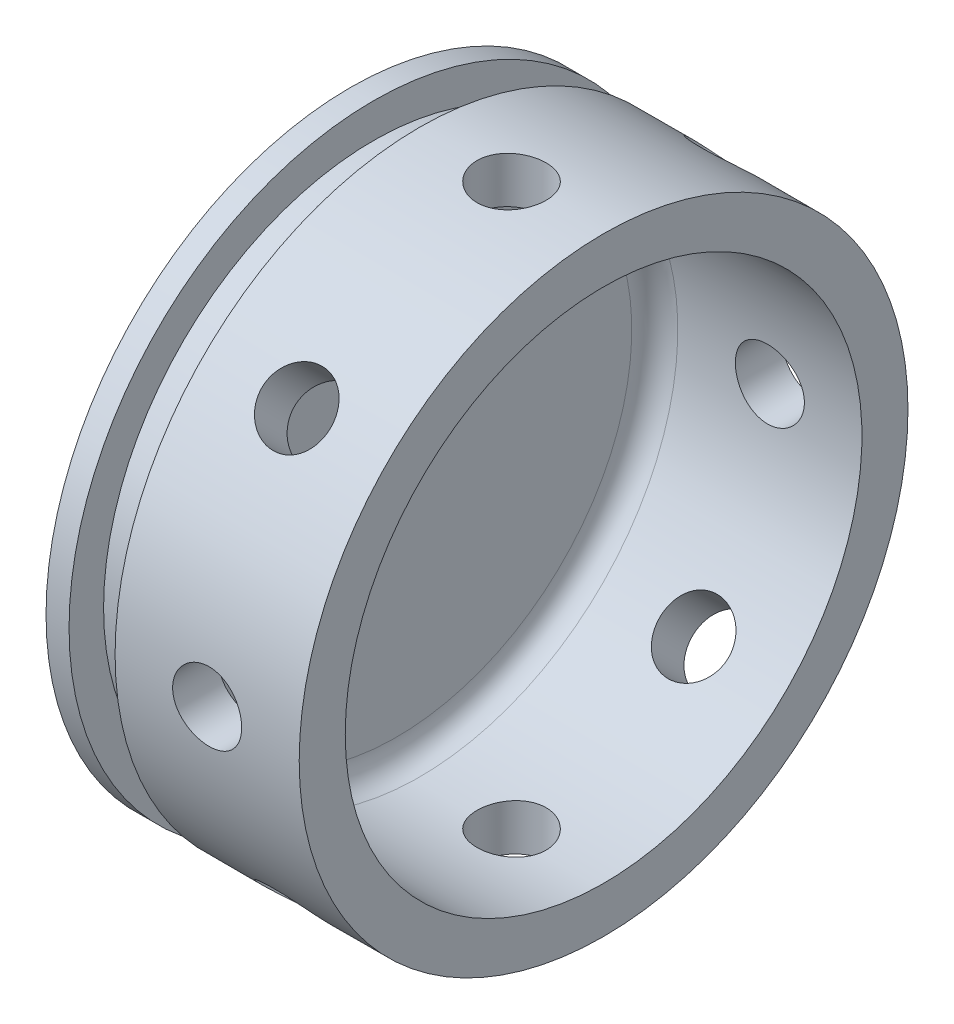
from build123d import *

# Parameters (mm, degrees)
SKETCH2_R          = 3
CUT_EXTRUDE1_DEPTH = 100
CIRPATTERN1_COUNT  = 8
FILLET1_R          = 2


with BuildPart() as part:
    # Sketch1 → Revolve1 (revolve)
    with BuildSketch(Plane(origin=(0, 0, 0), x_dir=(1, 0, 0), z_dir=(0, 1, 0)), mode=Mode.PRIVATE) as revolve1_sk:
        Polygon((0, 0), (0, 26.45), (2, 26.45), (2, 23.45), (6, 23.45), (6, 26.45), (22, 26.45), (22, 22.45), (4, 22.45), (4, 0), align=None)
    revolve(revolve1_sk.sketch.rotate(Axis((0, 0, 0), (1, 0, 0)), 180), axis=Axis((0, 0, 0), (1, 0, 0)))

    # Sketch2 → Cut-Extrude1 (cut)
    with BuildSketch(Plane(origin=(0, 0, 0), x_dir=(1, 0, 0), z_dir=(0, 1, 0))):
        with Locations(Location((14, 0, 0), (0, 0, 270))):
            Circle(SKETCH2_R)
    cut_extrude1 = extrude(amount=-CUT_EXTRUDE1_DEPTH, mode=Mode.SUBTRACT)

    # CirPattern1: Cut-Extrude1 ×8 about axis
    cirpattern1_axis = Axis((4, 0, 0), (1, 0, 0))
    for i in range(1, CIRPATTERN1_COUNT):
        add(cut_extrude1.rotate(cirpattern1_axis, i * 360 / CIRPATTERN1_COUNT), mode=Mode.SUBTRACT)

    # Fillet1
    fillet1_edges = [part.edges().sort_by_distance(p)[0] for p in [
        (4, 0, -22.45),
    ]]
    fillet(fillet1_edges, radius=FILLET1_R)


solid = part.part
